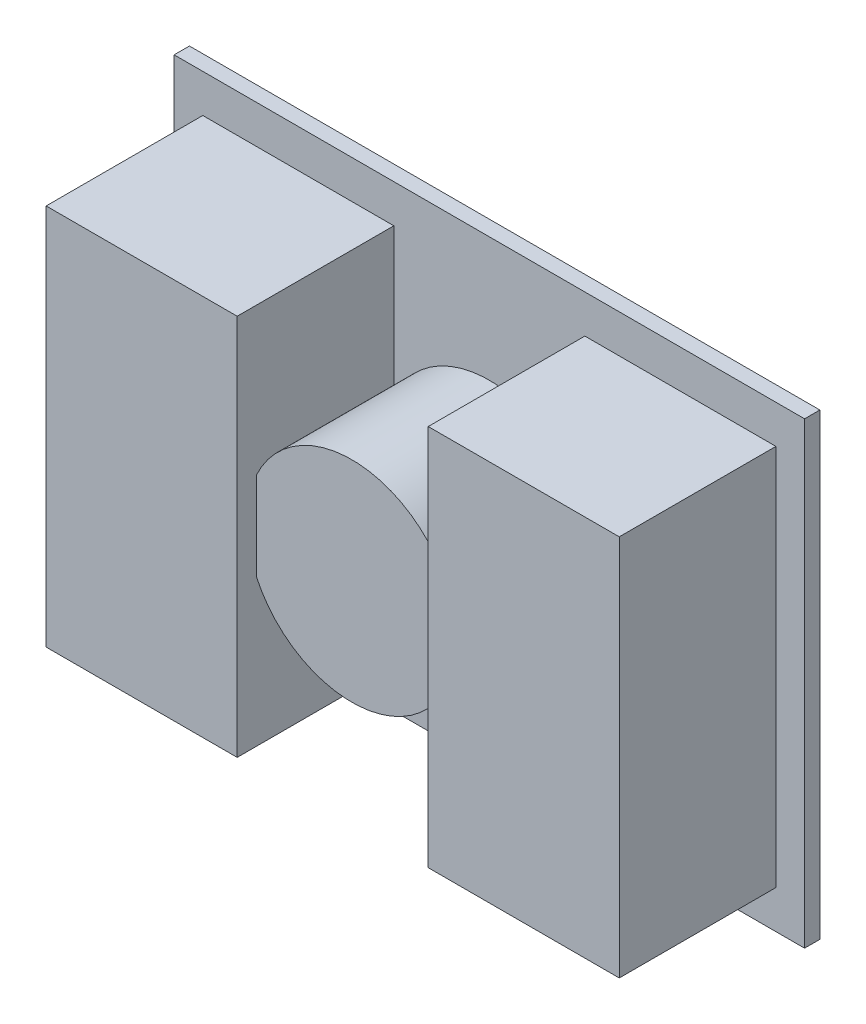
from build123d import *

# Parameters (mm, degrees)
SKETCH1_W          = 66
SKETCH1_H          = 48
PCB_DEPTH          = 1.6
SKETCH2_W          = 20
SKETCH2_H          = 40
HEATSINK_IN_DEPTH  = 16.4
SKETCH3_W          = 20
SKETCH3_H          = 40
HEATSINK_OUT_DEPTH = 16.4
SKETCH4_R          = 11
INDUCTOR_DEPTH     = 14.4


with BuildPart() as part:
    # Sketch1 → PCB (new body)
    with BuildSketch(Plane.XY):
        Rectangle(SKETCH1_W, SKETCH1_H)
    extrude(amount=PCB_DEPTH)

    # Sketch2 → Heatsink_in (add)
    with BuildSketch(Plane.XY.offset(1.6)):
        with Locations((-20, 0)):
            Rectangle(SKETCH2_W, SKETCH2_H)
    extrude(amount=HEATSINK_IN_DEPTH)

    # Sketch3 → Heatsink_out (add)
    with BuildSketch(Plane.XY.offset(1.6)):
        with Locations((20, 0)):
            Rectangle(SKETCH3_W, SKETCH3_H)
    extrude(amount=HEATSINK_OUT_DEPTH)

    # Sketch4 → Inductor (add)
    with BuildSketch(Plane.XY.offset(1.6)):
        Circle(SKETCH4_R)
    extrude(amount=INDUCTOR_DEPTH)


solid = part.part
